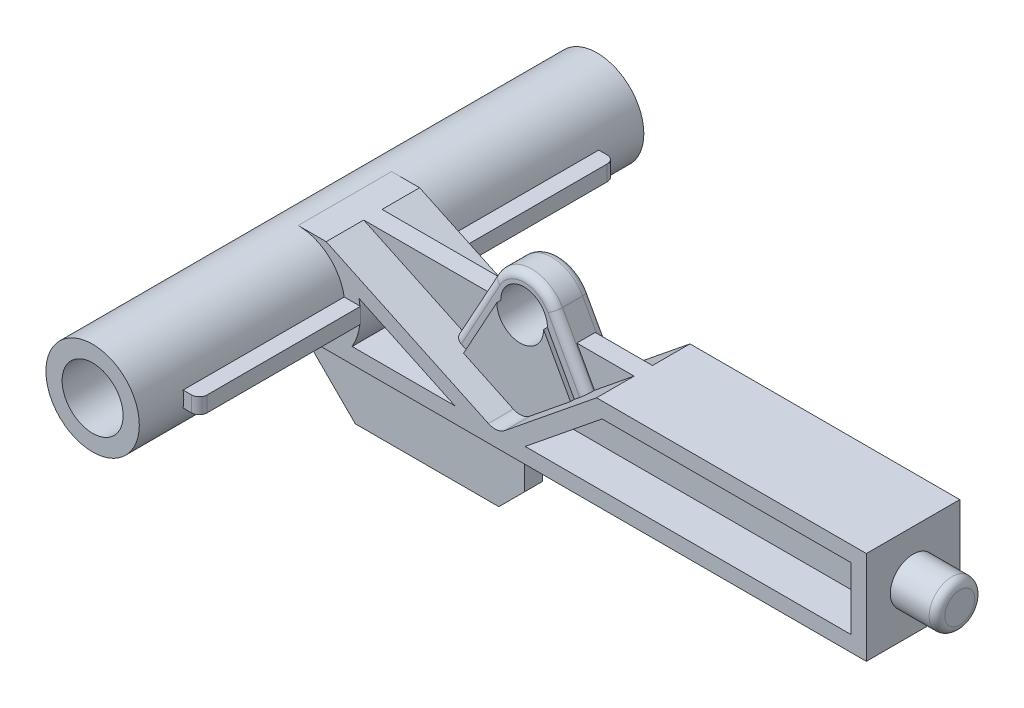
from build123d import *

# Parameters (mm, degrees)
BOSS_EXTRUDE3_DEPTH  = 3
SKETCH2_R            = 2.9999999999999982
BOSS_EXTRUDE4_DEPTH  = 16.205
SKETCH5_R            = 1.96
CUT_EXTRUDE2_DEPTH   = 32.80000000000002
SKETCH6_R            = 1.465
BOSS_EXTRUDE7_DEPTH  = 3
FILLET1_R            = 0.5
BOSS_EXTRUDE8_DEPTH  = 0.59
BOSS_EXTRUDE9_DEPTH  = 13.35
FILLET7_R            = 0.5
FILLET8_R            = 0.5
BOSS_EXTRUDE10_DEPTH = 3
CUT_EXTRUDE4_DEPTH   = 3
BOSS_EXTRUDE11_DEPTH = 0.59
BOSS_EXTRUDE12_DEPTH = 1.395
CUT_EXTRUDE6_DEPTH   = 20.895000000000014
CUT_EXTRUDE7_DEPTH   = 0.25
CUT_EXTRUDE8_DEPTH   = 0.25
FILLET9_R            = 0.5
FILLET10_R           = 0.5
CUT_EXTRUDE9_DEPTH   = 2.5
CUT_EXTRUDE10_DEPTH  = 2.5
CUT_EXTRUDE12_DEPTH  = 2.5
CUT_EXTRUDE14_START  = -2.5
CUT_EXTRUDE14_DEPTH  = 2.5


with BuildPart() as part:
    # Sketch1 → Boss-Extrude3 (new, symmetric)
    with BuildSketch(Plane.XY):
        with BuildLine():
            ThreePointArc((2.9999999999999982, 2.9999999999999973), (2.1213203435596406, 0.8786796564403563), (-5.5e-16, 0))
            Line((0, 0), (36.5, 0))
            Line((36.5, 0), (36.5, 6))
            Line((36.5, 6), (20.749999999999996, 5.999999999999999))
            ThreePointArc((20.749999999999996, 5.999999999999999), (20.435386233554034, 4.445031090493969), (19.54103584523481, 3.134669493650969))
            ThreePointArc((19.54103584523481, 3.1346694936509705), (17.593985916344508, 2.2872332130112563), (15.573673818645423, 2.9410609450836516))
            Line((15.573673818645423, 2.9410609450836516), (11.749999999999998, 5.9999999999999964))
            Line((11.749999999999998, 5.9999999999999964), (0, 5.9999999999999964))
            ThreePointArc((1.8e-16, 5.9999999999999964), (2.1213203435596415, 5.121320343559639), (2.9999999999999982, 2.9999999999999982))
        make_face()
    extrude(amount=BOSS_EXTRUDE3_DEPTH, both=True)

    # Sketch2 → Boss-Extrude4 (add, symmetric)
    with BuildSketch(Plane.XY):
        with Locations((0, 2.9999999999999982)):
            Circle(SKETCH2_R)
    extrude(amount=BOSS_EXTRUDE4_DEPTH, both=True)

    # Sketch5 → Cut-Extrude2 (cut)
    with BuildSketch(Plane.XY.offset(16.205)):
        with Locations((0, 2.9999999999999982)):
            Circle(SKETCH5_R)
    extrude(amount=-CUT_EXTRUDE2_DEPTH, mode=Mode.SUBTRACT)

    # Sketch6 → Boss-Extrude7 (add)
    with BuildSketch(Plane(origin=(36.5, 0, 0), x_dir=(0, 0, -1), z_dir=(1, 0, 0))):
        with Locations((0, 2.999999999999999)):
            Circle(SKETCH6_R)
    extrude(amount=BOSS_EXTRUDE7_DEPTH)

    # Fillet1
    fillet1_edges = [part.edges().sort_by_distance(p)[0] for p in [
        (39.5, 2.9999999999999987, 1.465),
    ]]
    fillet(fillet1_edges, radius=FILLET1_R)

    # Sketch12 → Boss-Extrude8 (add, symmetric)
    with BuildSketch(Plane.XY):
        with BuildLine():
            Line((12.12, -2.99e-15), (12.12, -3.970000000000003))
            Line((12.12, -3.970000000000003), (10.479512267647207, -5.6104877323527935))
            Line((10.479512267647207, -5.6104877323527935), (1.2595122676472073, -5.610487732352795))
            Line((1.2595122676472073, -5.610487732352795), (-2.8063517241754403, -1.5446237405301462))
            Line((-2.8063517241754403, -1.5446237405301462), (-2.8063517241754403, 1.939627423865778))
            ThreePointArc((-2.8063517241754403, 1.939627423865778), (-1.7057083970593148, 0.5320942351456543), (0, 0))
            Line((0, 0), (12.12, -2.99e-15))
        make_face()
    extrude(amount=BOSS_EXTRUDE8_DEPTH, both=True)

    # Sketch14 → Boss-Extrude9 (add, symmetric)
    with BuildSketch(Plane.XY):
        with BuildLine():
            Line((3.9999999999999982, 2.4999999999999982), (3.9999999999999982, 3.4999999999999982))
            Line((3.9999999999999982, 3.4999999999999982), (2.9580398915498067, 3.4999999999999982))
            ThreePointArc((2.9580398915498067, 3.4999999999999982), (2.999999999999999, 2.9999999999999982), (2.9580398915498067, 2.4999999999999982))
            Line((2.9580398915498067, 2.4999999999999982), (3.9999999999999982, 2.4999999999999982))
        make_face()
    extrude(amount=BOSS_EXTRUDE9_DEPTH, both=True)

    # Fillet7
    fillet7_edges = [part.edges().sort_by_distance(p)[0] for p in [
        (3.9999999999999982, 2.9999999999999982, 13.35),
    ]]
    fillet(fillet7_edges, radius=FILLET7_R)

    # Fillet8
    fillet8_edges = [part.edges().sort_by_distance(p)[0] for p in [
        (3.9999999999999982, 2.9999999999999982, -13.35),
    ]]
    fillet(fillet8_edges, radius=FILLET8_R)

    # Sketch15 → Boss-Extrude10 (add, symmetric)
    with BuildSketch(Plane.XY):
        Polygon((5.875, 5.9999999999999964), (27.07720850874597, 5.999999999999999), (27.07720850874597, 1.48970114733157), (5.875, 1.48970114733157), align=None)
    extrude(amount=BOSS_EXTRUDE10_DEPTH, both=True)

    # Sketch16 → Cut-Extrude4 (cut, symmetric)
    with BuildSketch(Plane.XY):
        with BuildLine():
            ThreePointArc((13.27019347571673, 1.2228284271177183), (12.760871493283885, 1.00722209344764), (12.214852275986694, 1.0953015306060352))
            Line((12.214852275986694, 1.0953015306060352), (1.8, 6))
            Line((1.8, 6), (19.169999999999998, 6.000000000000002))
            Line((19.169999999999998, 6.000000000000002), (13.27019347571673, 1.2228284271177183))
        make_face()
    extrude(amount=CUT_EXTRUDE4_DEPTH, both=True, mode=Mode.SUBTRACT)

    # Sketch17 → Boss-Extrude11 (add, symmetric)
    with BuildSketch(Plane.XY):
        Polygon((1.8, 6), (19.169999999999998, 5.999999999999999), (19.169999999999998, 0.49690997030879536), (1.8, 0.49690997030879536), (4.890483943976141, 2.396162656787146), align=None)
    extrude(amount=BOSS_EXTRUDE11_DEPTH, both=True)

    # Sketch19 → Boss-Extrude12 (add, symmetric)
    with BuildSketch(Plane.XY):
        with BuildLine():
            Line((8.17, 3.000156274700533), (10.684653005804094, 7.569117176028711))
            ThreePointArc((10.684653005804094, 7.569117176028711), (12.655773390851454, 8.734228825048191), (14.626946759842125, 7.569206818212221))
            Line((14.626946759842125, 7.569206818212221), (15.490695774172368, 5.999999999999999))
            Line((15.490695774172368, 5.999999999999999), (16.624997623308392, 3.9392692019970994))
            Line((16.624997623308392, 3.9392692019970994), (13.27019347571673, 1.2228284271177192))
            ThreePointArc((13.27019347571673, 1.2228284271177192), (12.760871493283883, 1.0072220934476446), (12.21485227598669, 1.0953015306060374))
            Line((12.21485227598669, 1.0953015306060374), (8.17, 3.000156274700533))
        make_face()
    extrude(amount=BOSS_EXTRUDE12_DEPTH, both=True)

    # Sketch20 → Cut-Extrude6 (cut, symmetric)
    with BuildSketch(Plane.XY.offset(1.395)):
        with BuildLine():
            ThreePointArc((14.155824552668768, 6.484228825629862), (12.655824552668768, 7.984228825629863), (11.155824552668768, 6.484228825629862))
            ThreePointArc((11.15582455266877, 6.484228825629865), (12.655824552668765, 4.984228825629861), (14.155824552668767, 6.484228825629859))
        make_face()
    extrude(amount=CUT_EXTRUDE6_DEPTH, both=True, mode=Mode.SUBTRACT)

    # Sketch21 → Cut-Extrude7 (cut, symmetric)
    with BuildSketch(Plane.XY.offset(1.395)):
        with BuildLine():
            Line((11.155824552668768, 6.484228825629862), (9.018377782257767, 2.60062711193924))
            Line((9.018377782257767, 2.60062711193924), (8.17, 3.000156274700535))
            Line((8.17, 3.000156274700535), (10.684653005804092, 7.569117176028711))
            ThreePointArc((10.684653005804092, 7.569117176028711), (12.655773390851452, 8.734228825048183), (14.626946759842125, 7.569206818212221))
            Line((14.626946759842125, 7.569206818212221), (16.62499762330839, 3.9392692019970985))
            Line((16.62499762330839, 3.9392692019970985), (15.886023032964967, 3.3409091724705715))
            Line((15.886023032964967, 3.3409091724705715), (14.155824552668767, 6.484228825629862))
            ThreePointArc((14.155824552668767, 6.484228825629862), (12.655824552668768, 4.984228825629862), (11.155824552668768, 6.484228825629862))
        make_face()
    extrude(amount=CUT_EXTRUDE7_DEPTH, both=True, mode=Mode.SUBTRACT)

    # Sketch22 → Cut-Extrude8 (cut, symmetric)
    with BuildSketch(Plane(origin=(0, 0, -1.395), x_dir=(-1, 0, 0), z_dir=(0, 0, -1))):
        with BuildLine():
            Line((-14.155824552668767, 6.484228825629862), (-15.886023032964967, 3.340909172470571))
            Line((-15.886023032964967, 3.340909172470571), (-16.624997623308392, 3.9392692019971034))
            Line((-16.624997623308392, 3.9392692019971034), (-14.626946759842125, 7.569206818212221))
            ThreePointArc((-14.626946759842125, 7.569206818212221), (-12.655773390851454, 8.73422882504819), (-10.684653005804092, 7.569117176028711))
            Line((-10.684653005804092, 7.569117176028711), (-8.17, 3.000156274700535))
            Line((-8.17, 3.000156274700535), (-9.018377782257769, 2.600627111939241))
            Line((-9.018377782257769, 2.600627111939241), (-11.155824552668768, 6.484228825629862))
            ThreePointArc((-11.155824552668768, 6.484228825629862), (-12.655824552668768, 4.984228825629864), (-14.155824552668767, 6.484228825629862))
        make_face()
    extrude(amount=CUT_EXTRUDE8_DEPTH, both=True, mode=Mode.SUBTRACT)

    # Fillet9
    fillet9_edges = [part.edges().sort_by_distance(p)[0] for p in [
        (15.625972191575258, 5.754238010104662, -1.145),
        (12.655773390851452, 8.73422882504819, -1.145),
        (9.427326502902046, 5.2846367253646225, -1.145),
    ]]
    fillet(fillet9_edges, radius=FILLET9_R)

    # Fillet10
    fillet10_edges = [part.edges().sort_by_distance(p)[0] for p in [
        (9.427326502902046, 5.2846367253646225, 1.145),
        (12.655773390851452, 8.734228825048183, 1.145),
        (15.625972191575258, 5.754238010104659, 1.145),
    ]]
    fillet(fillet10_edges, radius=FILLET10_R)

    # Sketch23 → Cut-Extrude9 (cut)
    with BuildSketch(Plane(origin=(0, 0, -3), x_dir=(-1, 0, 0), z_dir=(0, 0, -1))):
        Polygon((-35.5, 5), (-35.5, 1), (-14.230000308321648, 1), (-19.169999999999998, 5), align=None)
    extrude(amount=-CUT_EXTRUDE9_DEPTH, mode=Mode.SUBTRACT)

    # Sketch24 → Cut-Extrude10 (cut)
    with BuildSketch(Plane(origin=(0, 0, -3), x_dir=(-1, 0, 0), z_dir=(0, 0, -1))):
        with BuildLine():
            Line((-10.07009080824153, 1), (-3.4641016151377535, 1))
            ThreePointArc((-3.4641016151377535, 1), (-3.9566645904895195, 2.412798741174382), (-3.895636139676663, 3.9077549599121406))
            Line((-3.895636139676663, 3.9077549599121406), (-10.07009080824153, 1))
        make_face()
    extrude(amount=-CUT_EXTRUDE10_DEPTH, mode=Mode.SUBTRACT)

    # Sketch25 → Cut-Extrude12 (cut)
    with BuildSketch(Plane.XY.offset(3)):
        Polygon((19.524095671942906, 5), (35.5, 5), (35.5, 1), (14.584095980264548, 0.9999999999999983), align=None)
    extrude(amount=-CUT_EXTRUDE12_DEPTH, mode=Mode.SUBTRACT)

    # Sketch26 → Cut-Extrude14 (cut)
    with BuildSketch(Plane.XY.offset(3).offset(CUT_EXTRUDE14_START)):
        with BuildLine():
            Line((3.4641016151377535, 1), (10.070090808241538, 1))
            Line((10.070090808241538, 1), (3.8956361396766637, 3.9077549599121406))
            ThreePointArc((3.8956361396766637, 3.9077549599121406), (3.956664590489521, 2.4127987411743836), (3.4641016151377535, 1))
        make_face()
    extrude(amount=CUT_EXTRUDE14_DEPTH, mode=Mode.SUBTRACT)


solid = part.part
